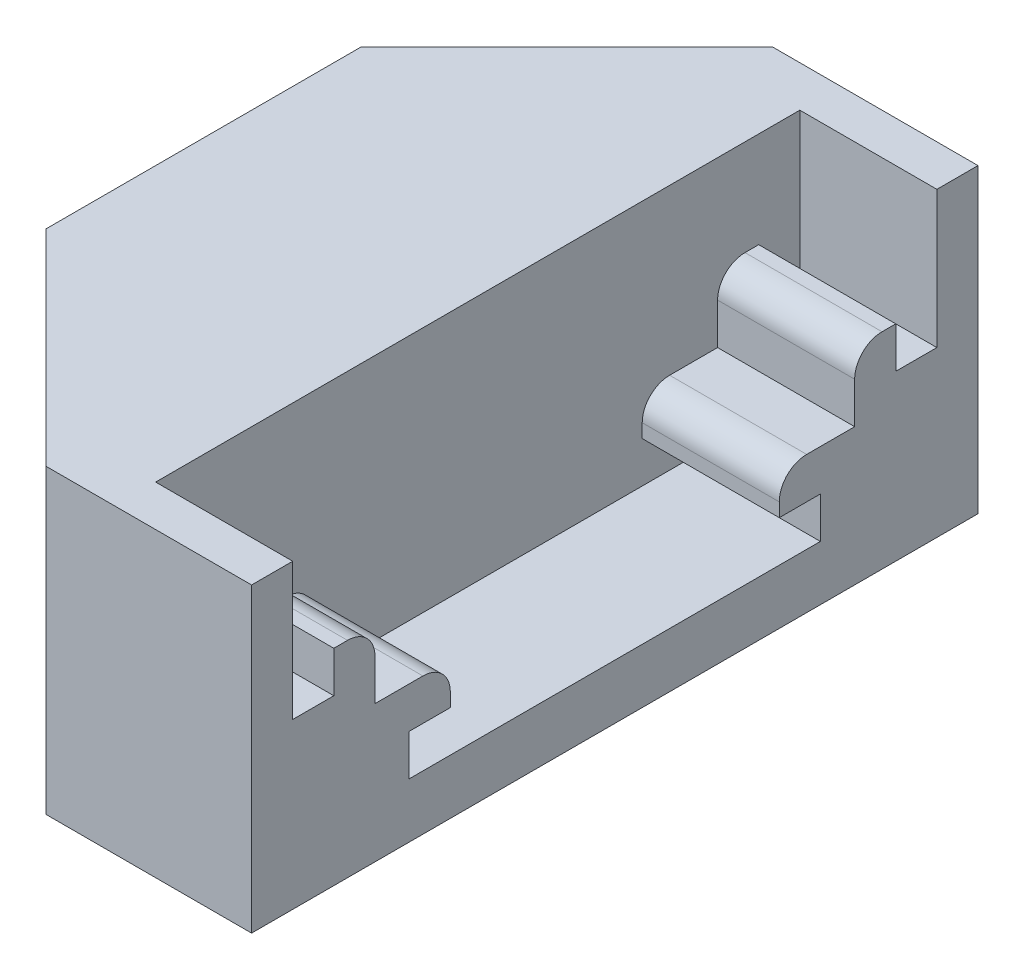
from build123d import *

# Parameters (mm, degrees)
BOSS_EXTRUDE1_DEPTH = 10
FILLET1_R           = 2
SKETCH2_W           = 26.5
SKETCH2_H           = 22
BOSS_EXTRUDE2_DEPTH = 20
CHAMFER1_SIZE       = 15


with BuildPart() as part:
    # Sketch1 → Boss-Extrude1 (new body)
    with BuildSketch(Plane(origin=(0, 0, 0), x_dir=(0, 0, -1), z_dir=(1, 0, 0))):
        Polygon((-26.5, -27.5), (-26.5, -5.5), (-23.5, -5.5), (-23.5, -15.5), (-20.5, -15.5), (-20.5, -12.5), (-17.5, -12.5), (-17.5, -17.5), (-12, -17.5), (-12, -20.5), (-15, -20.5), (-15, -23.5), (0, -23.5), (0, -27.5), align=None)
    extrude(amount=BOSS_EXTRUDE1_DEPTH)

    # Fillet1
    fillet1_edges = [part.edges().sort_by_distance(p)[0] for p in [
        (5, -12.5, 17.5),
        (5, -17.5, 12),
    ]]
    fillet(fillet1_edges, radius=FILLET1_R)

    # Sketch2 → Boss-Extrude2 (add)
    with BuildSketch(Plane.ZY):
        with Locations((13.25, -16.5)):
            Rectangle(SKETCH2_W, SKETCH2_H)
    extrude(amount=BOSS_EXTRUDE2_DEPTH)

    # Chamfer1
    chamfer1_edges = [part.edges().sort_by_distance(p)[0] for p in [
        (-20, -16.5, 26.5),
    ]]
    chamfer(chamfer1_edges, length=CHAMFER1_SIZE)

    # Mirror1: part across plane


with BuildPart() as part_1:
    add(part.part)
    add(part.part.mirror(Plane(origin=(10, -23.5, 0), x_dir=(1, 0, 0), z_dir=(0, 0, 1))))


solid = part_1.part
